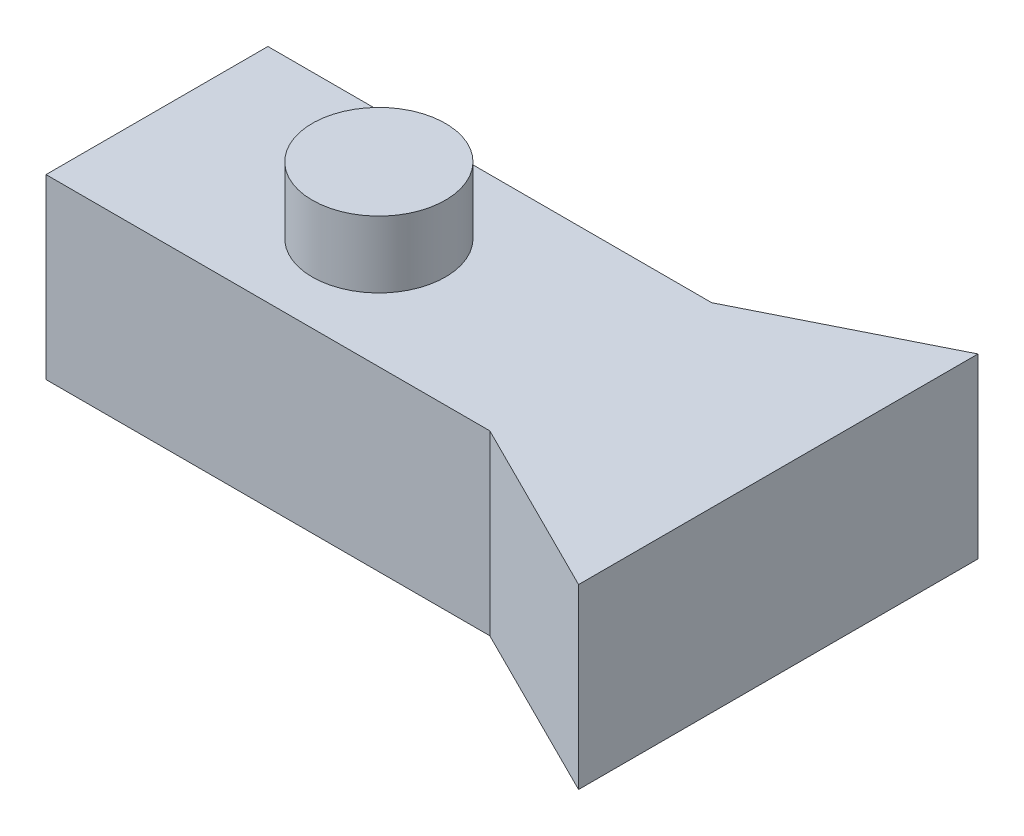
from build123d import *

# Parameters (mm, degrees)
SKETCH1_W           = 1000
SKETCH1_H           = 500
BOSS_EXTRUDE1_DEPTH = 400
SKETCH2_R           = 150
BOSS_EXTRUDE2_DEPTH = 150


with BuildPart() as part:
    # Sketch1 → Boss-Extrude1 (new body)
    with BuildSketch(Plane(origin=(0, 0, 0), x_dir=(1, 0, 0), z_dir=(0, 1, 0))):
        Polygon((1400, -200), (1000, 0), (1000, 500), (1400, 700), align=None)
        with Locations((500, 250)):
            Rectangle(SKETCH1_W, SKETCH1_H)
    extrude(amount=BOSS_EXTRUDE1_DEPTH)

    # Sketch2 → Boss-Extrude2 (add)
    with BuildSketch(Plane(origin=(0, 400, 0), x_dir=(1, 0, 0), z_dir=(0, 1, 0))):
        with Locations(Location((500, 250, 0), (0, 0, 270))):
            Circle(SKETCH2_R)
    extrude(amount=BOSS_EXTRUDE2_DEPTH)


solid = part.part
